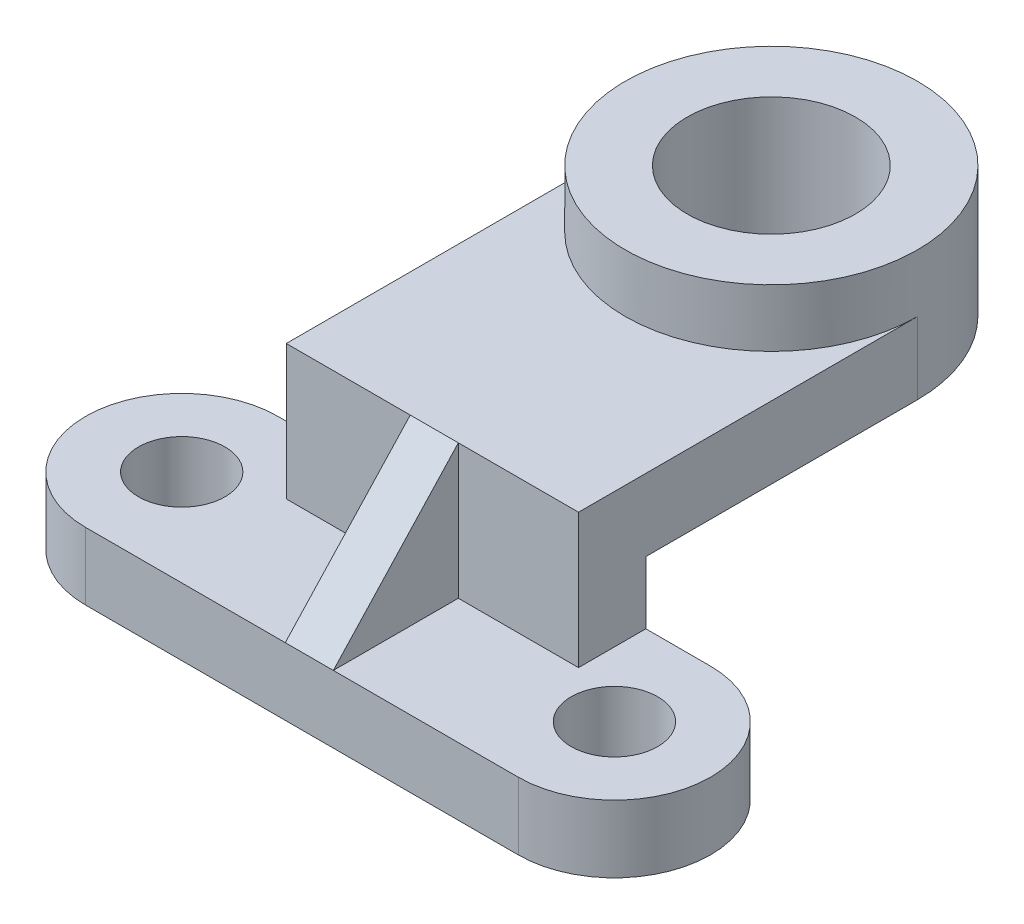
from build123d import *

# Parameters (mm, degrees)
SKETCH_1_R          = 18
EXTRUDE_1_DEPTH     = 28
SKETCH_2_W          = 121.577423065
SKETCH_2_H          = 141
EXTRUDE_2_DEPTH     = 56
SKETCH_5_W          = 113
SKETCH_5_H          = 26
CUT_EXTRUDE_1_DEPTH = 180
SKETCH_7_R          = 60.788711533
SKETCH_7_R_2        = 35
EXTRUDE_4_DEPTH     = 54
EXTRUDE_START       = -70
EXTRUDE_5_DEPTH     = 20
CUT_EXTRUDE_START   = -20
SKETCH_9_R          = 35
CUT_EXTRUDE_2_DEPTH = 20
CUT_EXTRUDE_5_DEPTH = 236.915979109


with BuildPart() as part:
    # 스케치1 → 보스-돌출1 (new body)
    with BuildSketch(Plane(origin=(0, 0, 0), x_dir=(1, 0, 0), z_dir=(0, 1, 0))):
        with BuildLine():
            Line((-48.732108463, -34.980719949), (131.267891537, -34.980719949))
            ThreePointArc((131.267891537, -34.980719949), (171.267891537, -74.980719949), (131.267891537, -114.980719949))
            Line((131.267891537, -114.980719949), (-48.732108463, -114.980719949))
            ThreePointArc((-48.732108463, -114.980719949), (-88.732108463, -74.980719949), (-48.732108463, -34.980719949))
        make_face()
        with Locations(Location((-48.732108463, -74.980719949, 0), (0, 0, 270))):
            Circle(SKETCH_1_R, mode=Mode.SUBTRACT)
        with Locations(Location((131.267891537, -74.980719949, 0), (0, 0, 270))):
            Circle(SKETCH_1_R, mode=Mode.SUBTRACT)
    extrude(amount=EXTRUDE_1_DEPTH)

    # 스케치2 → 보스-돌출2 (add)
    with BuildSketch(Plane(origin=(0, 28, 0), x_dir=(1, 0, 0), z_dir=(0, 1, 0))):
        with Locations((43.54746822, 7.519280051)):
            Rectangle(SKETCH_2_W, SKETCH_2_H)
    extrude(amount=EXTRUDE_2_DEPTH)

    # 스케치5 → 컷-돌출1 (cut)
    with BuildSketch(Plane(origin=(104.336179752, 0, 0), x_dir=(0, 0, -1), z_dir=(1, 0, 0))):
        with Locations((21.519280051, 41)):
            Rectangle(SKETCH_5_W, SKETCH_5_H)
    extrude(amount=-CUT_EXTRUDE_1_DEPTH, mode=Mode.SUBTRACT)

    # 스케치7 → 보스-돌출4 (add)
    with BuildSketch(Plane.XZ.offset(-54)):
        with Locations(Location((43.54746822, -78.019280051, 0), (0, 0, 270))):
            Circle(SKETCH_7_R)
        with Locations(Location((43.54746822, -78.019280051, 0), (0, 0, 270))):
            Circle(SKETCH_7_R_2, mode=Mode.SUBTRACT)
    extrude(amount=-EXTRUDE_4_DEPTH)

    # 스케치8 → 보스-돌출5 (add)
    with BuildSketch(Plane(origin=(104.336179752, 0, 0), x_dir=(0, 0, -1), z_dir=(1, 0, 0)).offset(EXTRUDE_START)):
        Polygon((-114.980719949, 28), (-62.980719949, 84), (-62.980719949, 28), align=None)
    extrude(amount=EXTRUDE_5_DEPTH)

    # 스케치9 → 컷-돌출2 (cut)
    with BuildSketch(Plane(origin=(0, 84, 0), x_dir=(1, 0, 0), z_dir=(0, 1, 0)).offset(CUT_EXTRUDE_START)):
        with Locations(Location((43.54746822, 78.019280051, 0), (0, 0, 90))):
            Circle(SKETCH_9_R)
    extrude(amount=CUT_EXTRUDE_2_DEPTH, mode=Mode.SUBTRACT)

    # 스케치11 → 컷-돌출5 (cut, through all)
    with BuildSketch(Plane(origin=(0, 84, 0), x_dir=(1, 0, 0), z_dir=(0, 1, 0))):
        with BuildLine():
            Line((78.54746822, 78.019280051), (8.54746822, 78.019280051))
            ThreePointArc((8.54746822, 78.019280051), (43.54746822, 43.019280051), (78.54746822, 78.019280051))
        make_face()
    extrude(amount=-CUT_EXTRUDE_5_DEPTH, mode=Mode.SUBTRACT)


solid = part.part
